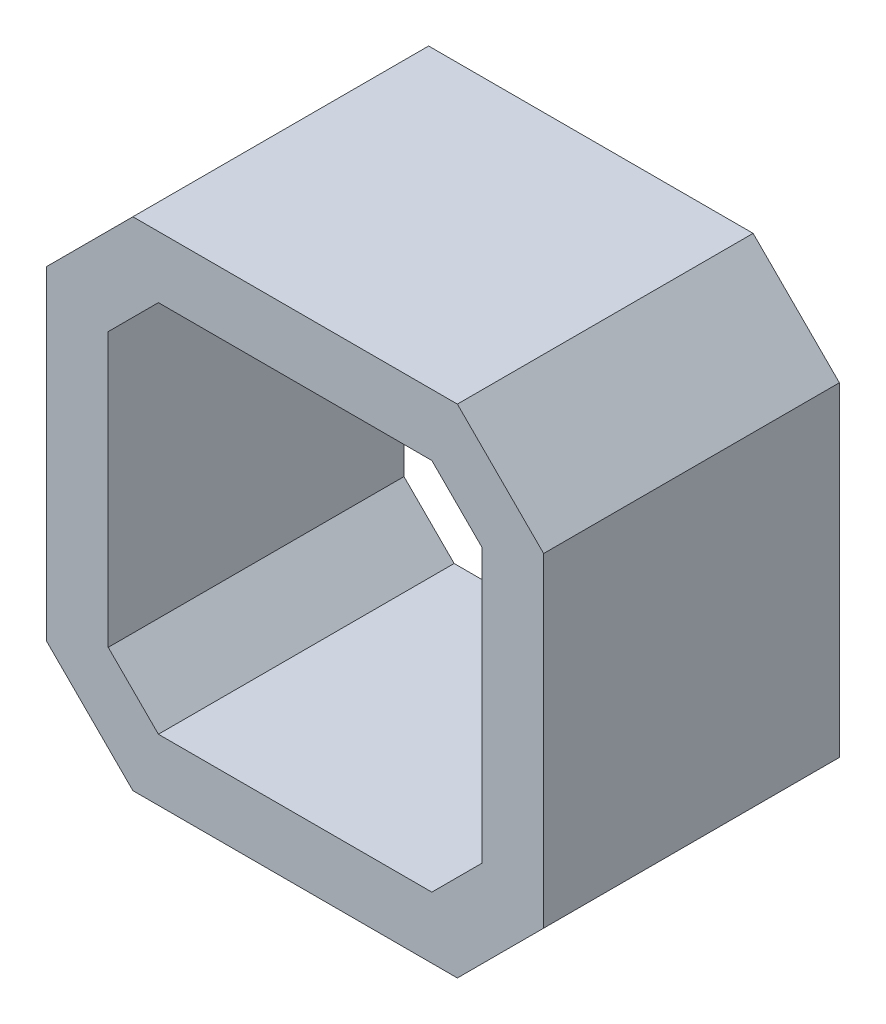
from build123d import *

# Parameters (mm, degrees)
BOSS_EXTRUDE1_DEPTH = 72
ESCALA2_SCALE       = 0.5


with BuildPart() as part:
    # Sketch1 → Boss-Extrude1 (new body)
    with BuildSketch(Plane.XY):
        Polygon((-39.5, 60.5), (-60.5, 39.5), (-60.5, -39.5), (-39.5, -60.5), (39.5, -60.5), (60.5, -39.5), (60.5, 39.5), (39.5, 60.5), align=None)
        Polygon((33.286796564, 45.5), (-33.286796564, 45.5), (-45.5, 33.286796564), (-45.5, -33.286796564), (-33.286796564, -45.5), (33.286796564, -45.5), (45.5, -33.286796564), (45.5, 33.286796564), align=None, mode=Mode.SUBTRACT)
    extrude(amount=BOSS_EXTRUDE1_DEPTH)


with BuildPart() as part_1:
    # Escala2: scaled about (0, 0, 36)
    add(part.part.scale(ESCALA2_SCALE).moved(Location((0, 0, 18))))


solid = part_1.part
